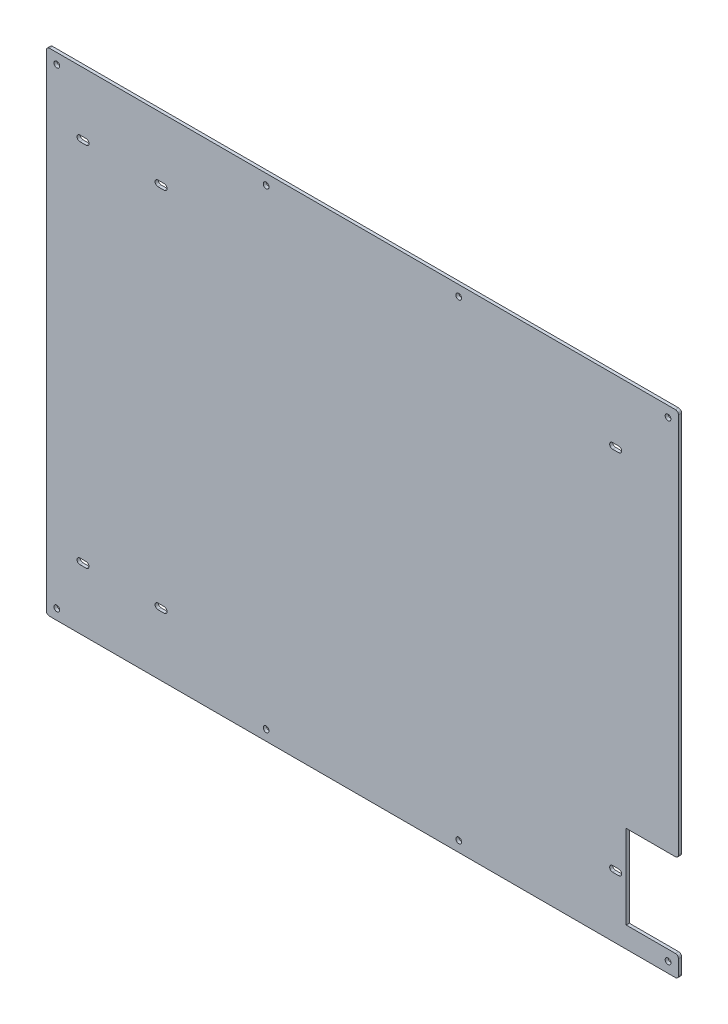
from build123d import *

# Parameters (mm, degrees)
SKETCH1_W            = 604
SKETCH1_H            = 470
BOSS_EXTRUDE1_DEPTH  = 3
FILLET1_R            = 3
M5_CLEARANCE_HOLE1_D = 5.5
CUT_EXTRUDE5_DEPTH   = 766.326727614
SKETCH10_W           = 50
SKETCH10_H           = 80
CUT_EXTRUDE6_DEPTH   = 766.326727614
FILLET5_R            = 3


with BuildPart() as part:
    # Sketch1 → Boss-Extrude1 (new body)
    with BuildSketch(Plane.XY):
        with Locations((302, 235)):
            Rectangle(SKETCH1_W, SKETCH1_H)
    extrude(amount=BOSS_EXTRUDE1_DEPTH)

    # Fillet1
    fillet1_edges = [part.edges().sort_by_distance(p)[0] for p in [
        (0, 470, 1.5),
        (604, 470, 1.5),
        (604, 0, 1.5),
        (0, 0, 1.5),
    ]]
    fillet(fillet1_edges, radius=FILLET1_R)

    # M5 Clearance Hole1 (through all)
    with Locations(Plane(origin=(0, 0, 0), x_dir=(-1, 0, 0), z_dir=(0, 0, -1))):
        with Locations((-594, 460), (-394, 460), (-210, 460), (-10, 460), (-10, 10), (-210, 10), (-394, 10), (-594, 10), (-544, 410), (-544, 60), (-35, 410), (-35, 60), (-109.625, 410), (-109.625, 60)):
            Hole(M5_CLEARANCE_HOLE1_D / 2)

    # Sketch9 → Cut-Extrude5 (cut, through all)
    with BuildSketch(Plane.XY.offset(3)):
        with BuildLine():
            Line((32, 412.75), (38, 412.75))
            ThreePointArc((38, 412.75), (40.75, 410), (38, 407.25))
            Line((38, 407.25), (32, 407.25))
            ThreePointArc((32, 407.25), (29.25, 410), (32, 412.75))
        make_face()
        with BuildLine():
            Line((106.625, 412.75), (112.625, 412.75))
            ThreePointArc((112.625, 412.75), (115.375, 410), (112.625, 407.25))
            Line((112.625, 407.25), (106.625, 407.25))
            ThreePointArc((106.625, 407.25), (103.875, 410), (106.625, 412.75))
        make_face()
        with BuildLine():
            Line((32, 62.75), (38, 62.75))
            ThreePointArc((38, 62.75), (40.75, 60), (38, 57.25))
            Line((38, 57.25), (32, 57.25))
            ThreePointArc((32, 57.25), (29.25, 60), (32, 62.75))
        make_face()
        with BuildLine():
            Line((106.625, 62.75), (112.625, 62.75))
            ThreePointArc((112.625, 62.75), (115.375, 60), (112.625, 57.25))
            Line((112.625, 57.25), (106.625, 57.25))
            ThreePointArc((106.625, 57.25), (103.875, 60), (106.625, 62.75))
        make_face()
        with BuildLine():
            Line((541, 412.75), (547, 412.75))
            ThreePointArc((547, 412.75), (549.75, 410), (547, 407.25))
            Line((547, 407.25), (541, 407.25))
            ThreePointArc((541, 407.25), (538.25, 410), (541, 412.75))
        make_face()
        with BuildLine():
            Line((541, 62.75), (547, 62.75))
            ThreePointArc((547, 62.75), (549.75, 60), (547, 57.25))
            Line((547, 57.25), (541, 57.25))
            ThreePointArc((541, 57.25), (538.25, 60), (541, 62.75))
        make_face()
    extrude(amount=-CUT_EXTRUDE5_DEPTH, mode=Mode.SUBTRACT)

    # Sketch10 → Cut-Extrude6 (cut, through all)
    with BuildSketch(Plane.XY.offset(3)):
        with Locations((579, 60)):
            Rectangle(SKETCH10_W, SKETCH10_H)
    extrude(amount=-CUT_EXTRUDE6_DEPTH, mode=Mode.SUBTRACT)

    # Fillet5
    fillet5_edges = [part.edges().sort_by_distance(p)[0] for p in [
        (604, 100, 1.5),
        (604, 20, 1.5),
    ]]
    fillet(fillet5_edges, radius=FILLET5_R)


solid = part.part
